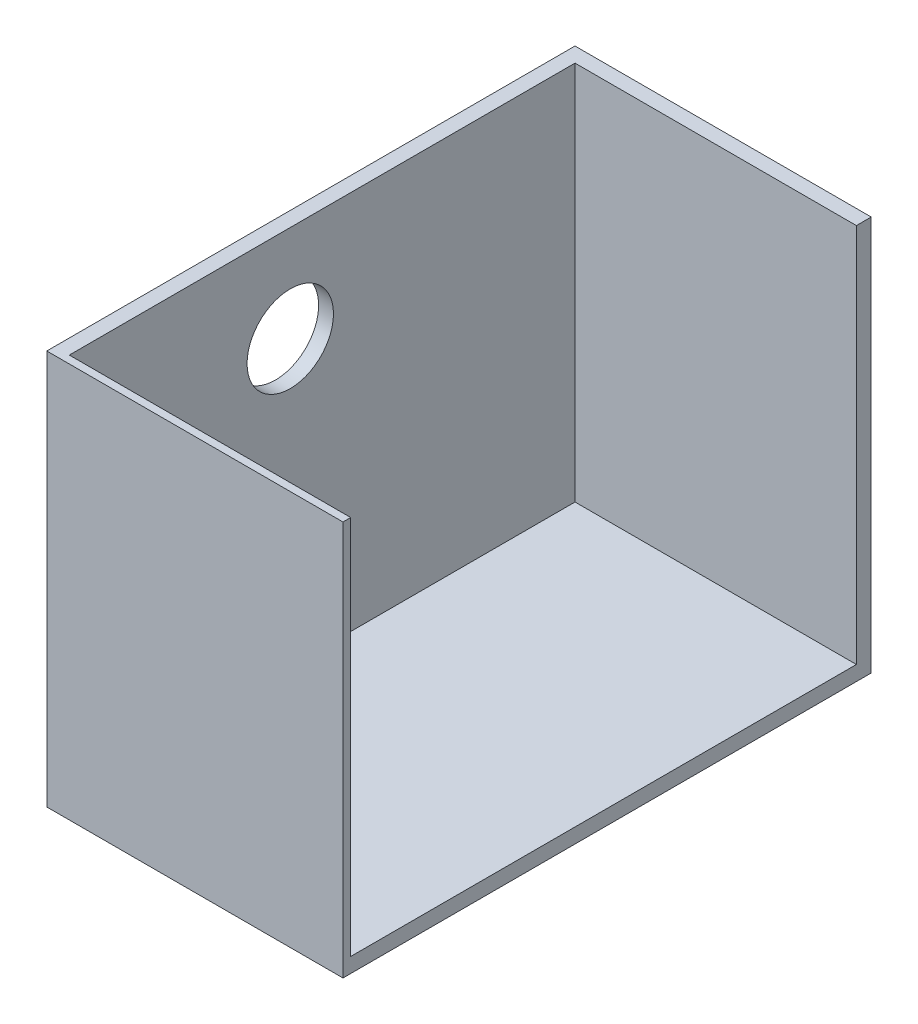
from build123d import *

# Parameters (mm, degrees)
SKETCH1_W                 = 120
SKETCH1_H                 = 214
BOSS_EXTRUDE1_DEPTH       = 160
SHELL1_T                  = -6
SHELL1_THICKNESS_3_FACE_W = 114
SHELL1_THICKNESS_3_FACE_H = 154
SHELL1_THICKNESS_3_DEPTH  = 2.875
CUT_EXTRUDE1_REACH        = 228.824
SKETCH4_R                 = 17.5


with BuildPart() as part:
    # Sketch1 → Boss-Extrude1 (new body)
    with BuildSketch(Plane(origin=(0, 0, 0), x_dir=(1, 0, 0), z_dir=(0, 1, 0))):
        Rectangle(SKETCH1_W, SKETCH1_H)
    extrude(amount=BOSS_EXTRUDE1_DEPTH)

    # Shell1
    shell1_openings = [part.faces().sort_by_distance(p)[0] for p in [
        (0, 160, 0),
        (60, 80, 0),
    ]]
    offset(amount=SHELL1_T, openings=shell1_openings, kind=Kind.INTERSECTION)

    # Shell1 thickness 3 face (on inner face of the shell) → Shell1 thickness 3 (cut)
    with BuildSketch(Plane(origin=(3, 83, 101), x_dir=(1, 0, 0), z_dir=(0, 0, 1))):
        Rectangle(SHELL1_THICKNESS_3_FACE_W, SHELL1_THICKNESS_3_FACE_H)
    extrude(amount=SHELL1_THICKNESS_3_DEPTH, mode=Mode.SUBTRACT)

    # Sketch4 → Cut-Extrude1 (cut, up to next)
    with BuildSketch(Plane.ZY.offset(60), mode=Mode.PRIVATE) as cut_extrude1_sk1:
        with Locations((14.361495045, 120.976954776)):
            Circle(SKETCH4_R)
    cut_extrude1_tool1 = extrude(cut_extrude1_sk1.sketch, amount=-CUT_EXTRUDE1_REACH, mode=Mode.PRIVATE) & part.part
    add(cut_extrude1_tool1.solids().sort_by_distance((-60, 120.976955, 14.361495))[0], mode=Mode.SUBTRACT)


solid = part.part
